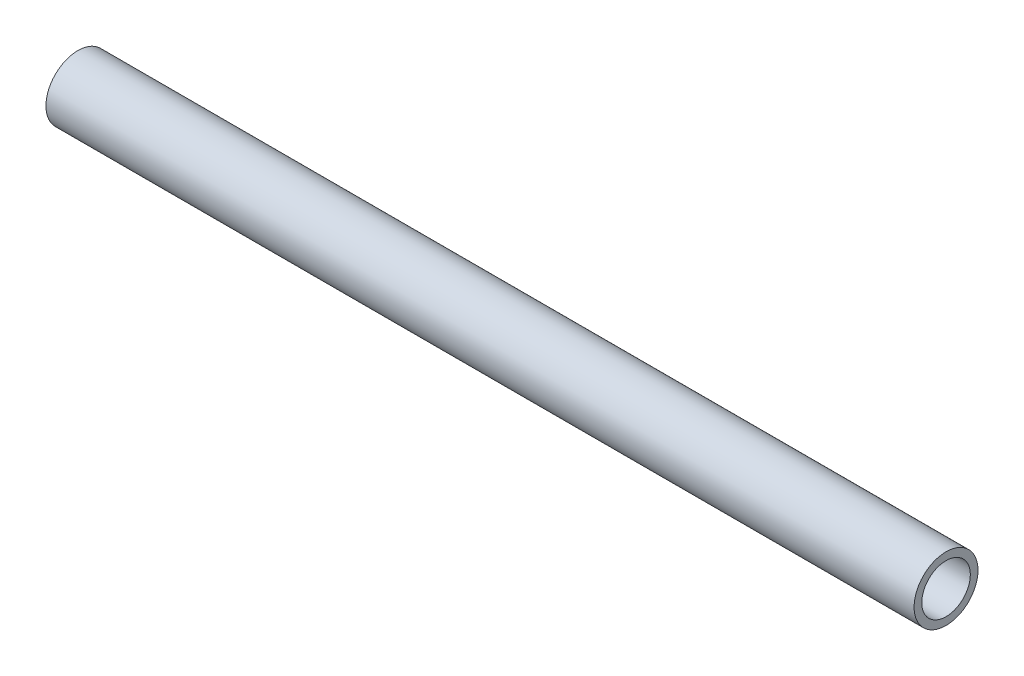
from build123d import *

# Parameters (mm, degrees)
SKETCH1_R           = 12.7
SKETCH1_R_2         = 9.652
BOSS_EXTRUDE1_DEPTH = 345


with BuildPart() as part:
    # Sketch1 → Boss-Extrude1 (new body)
    with BuildSketch(Plane(origin=(0, 0, 0), x_dir=(0, 0, -1), z_dir=(1, 0, 0))):
        Circle(SKETCH1_R)
        Circle(SKETCH1_R_2, mode=Mode.SUBTRACT)
    extrude(amount=BOSS_EXTRUDE1_DEPTH)


solid = part.part
